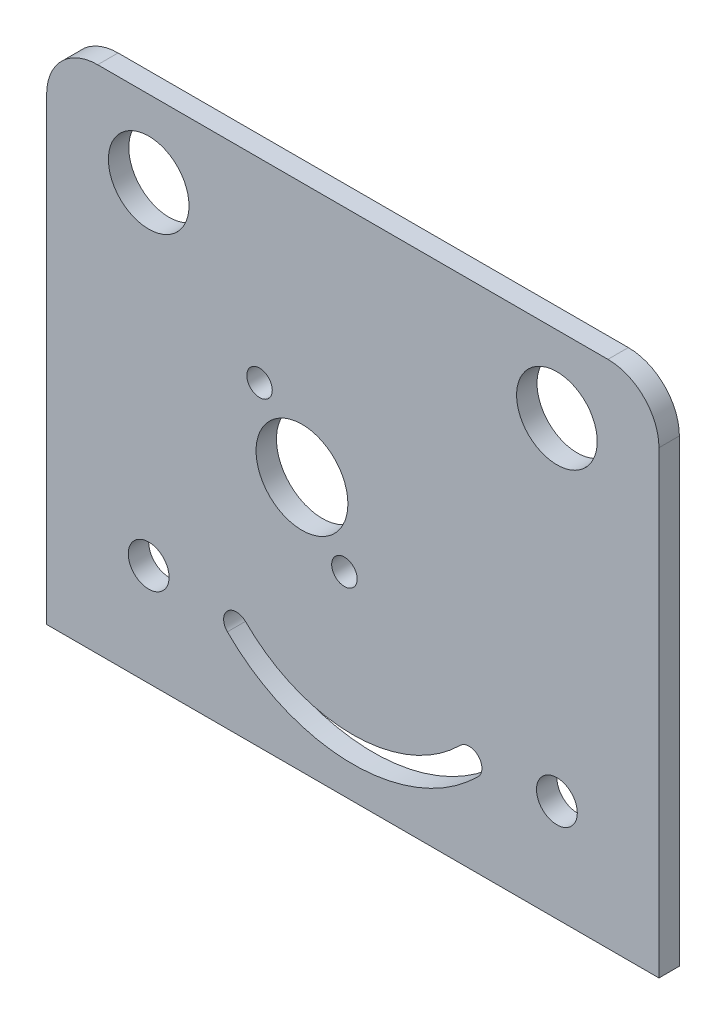
from build123d import *

# Parameters (mm, degrees)
SKETCH1_R           = 7.9
SKETCH1_R_2         = 9
SKETCH1_R_3         = 2.5
SKETCH1_R_4         = 4
BOSS_EXTRUDE1_DEPTH = 4


with BuildPart() as part:
    # Sketch1 → Boss-Extrude1 (new body)
    with BuildSketch(Plane.XY):
        with BuildLine():
            Line((0, 0), (120, 0))
            Line((120, 0), (120, 90))
            ThreePointArc((120, 90), (117.071067812, 97.071067812), (110, 100))
            Line((110, 100), (10, 100))
            ThreePointArc((10, 100), (2.928932188, 97.071067812), (0, 90))
            Line((0, 90), (0, 0))
        make_face()
        with Locations((100, 85)):
            Circle(SKETCH1_R, mode=Mode.SUBTRACT)
        with Locations((20, 85)):
            Circle(SKETCH1_R, mode=Mode.SUBTRACT)
        with Locations((50.040016013, 50)):
            Circle(SKETCH1_R_2, mode=Mode.SUBTRACT)
        with Locations((58.359688144, 38.124266101)):
            Circle(SKETCH1_R_3, mode=Mode.SUBTRACT)
        with Locations((41.720343882, 61.875733899)):
            Circle(SKETCH1_R_3, mode=Mode.SUBTRACT)
        with Locations((100, 20)):
            Circle(SKETCH1_R_4, mode=Mode.SUBTRACT)
        with Locations((20, 20)):
            Circle(SKETCH1_R_4, mode=Mode.SUBTRACT)
        with BuildLine():
            ThreePointArc((38.959835733, 20), (60, 11.284878606), (81.040164267, 20))
            ThreePointArc((81.040164267, 20), (84.575698173, 20), (84.575698173, 16.464466094))
            ThreePointArc((84.575698173, 16.464466094), (60, 6.284878606), (35.424301827, 16.464466094))
            ThreePointArc((35.424301827, 16.464466094), (35.424301827, 20), (38.959835733, 20))
        make_face(mode=Mode.SUBTRACT)
    extrude(amount=BOSS_EXTRUDE1_DEPTH)


solid = part.part
